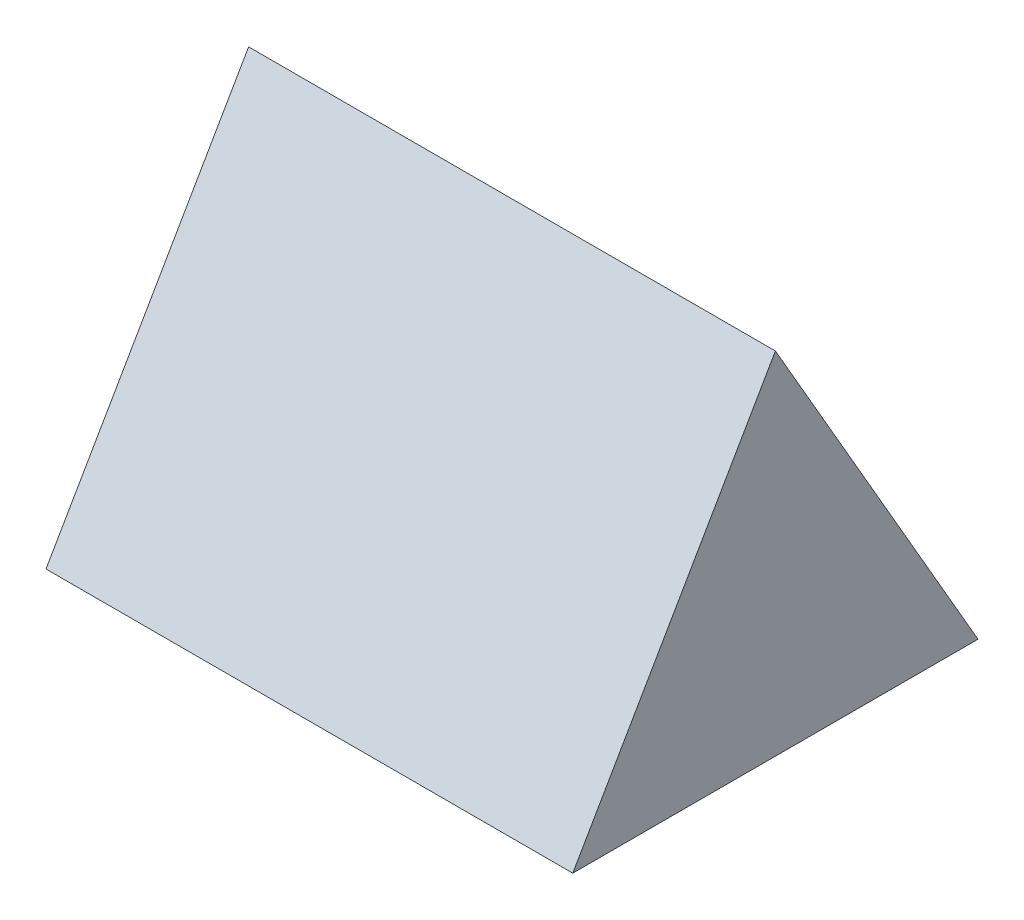
from build123d import *

# Parameters (mm, degrees)
EXTRUDE_1_DEPTH = 65


with BuildPart() as part:
    # 草图1 → 凸台-拉伸1 (new, symmetric)
    with BuildSketch(Plane(origin=(0, 0, 0), x_dir=(0, 0, -1), z_dir=(1, 0, 0))):
        Polygon((-50, -43.301270189), (50, -43.301270189), (0, 43.301270189), align=None)
    extrude(amount=EXTRUDE_1_DEPTH, both=True)


solid = part.part
